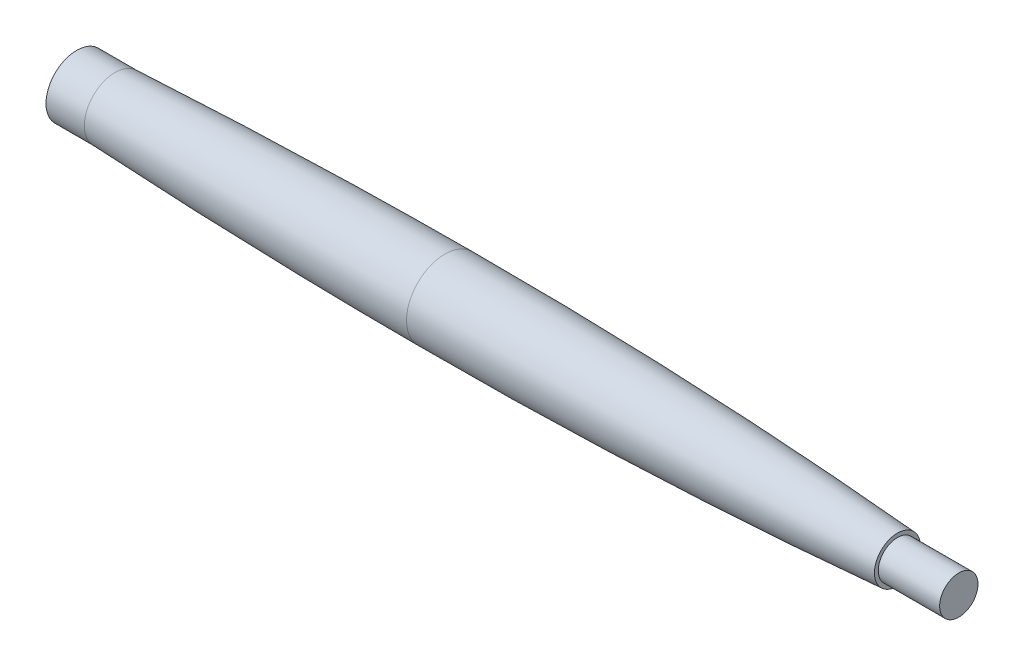
from build123d import *

# Parameters (mm, degrees)
SKETCH2_R           = 4
BOSS_EXTRUDE1_DEPTH = 5
SKETCH3_R           = 2.5
BOSS_EXTRUDE2_DEPTH = 8


with BuildPart() as part:
    # Sketch1 → Revolve1 (revolve)
    with BuildSketch(Plane.XY, mode=Mode.PRIVATE) as revolve1_sk:
        with BuildLine():
            Line((-43, 4), (-43, 0))
            Line((-43, 0), (0, 0))
            Line((0, 0), (59, 0))
            Line((59, 0), (59, 3))
            ThreePointArc((59, 3), (29.518026244, 4.531774184), (0, 5))
            ThreePointArc((0, 5), (-21.505272288, 4.726708379), (-43, 4))
        make_face()
    revolve(revolve1_sk.sketch.rotate(Axis((0, 0, 0), (1, 0, 0)), 90), axis=Axis((0, 0, 0), (1, 0, 0)))

    # Sketch3 → Boss-Extrude2 (add)
    with BuildSketch(Plane(origin=(59, 0, 0), x_dir=(0, 0, -1), z_dir=(1, 0, 0))):
        Circle(SKETCH3_R)
    extrude(amount=BOSS_EXTRUDE2_DEPTH)


with BuildPart() as body_2:
    # Sketch2 → Boss-Extrude1 (new body)
    with BuildSketch(Plane.ZY.offset(43)):
        Circle(SKETCH2_R)
    extrude(amount=BOSS_EXTRUDE1_DEPTH)


solid = Compound([part.part, body_2.part])
